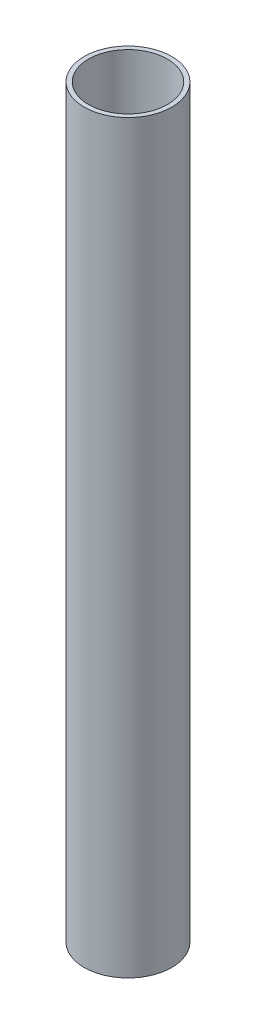
from build123d import *

# Parameters (mm, degrees)
SKETCH1_R           = 10
SKETCH1_R_2         = 9
BOSS_EXTRUDE1_DEPTH = 170


with BuildPart() as part:
    # Sketch1 → Boss-Extrude1 (new body)
    with BuildSketch(Plane(origin=(0, 0, 0), x_dir=(1, 0, 0), z_dir=(0, 1, 0))):
        with Locations(Location((0, 0, 0), (0, 0, 270))):
            Circle(SKETCH1_R)
        with Locations(Location((0, 0, 0), (0, 0, 270))):
            Circle(SKETCH1_R_2, mode=Mode.SUBTRACT)
    extrude(amount=BOSS_EXTRUDE1_DEPTH)


solid = part.part
